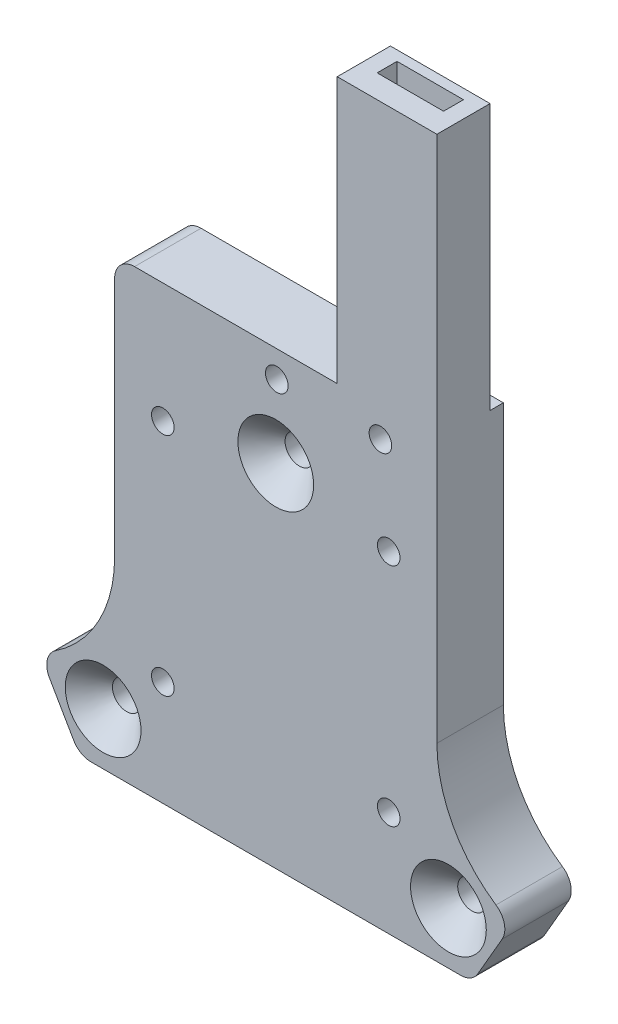
from build123d import *

# Parameters (mm, degrees)
SKETCH2_R                                       = 7.5
BOSS_EXTRUDE1_DEPTH                             = 10
CSK_FOR_M4_FLAT_HEAD_MACHINE_SCREW1_D           = 4.3
CSK_FOR_M4_FLAT_HEAD_MACHINE_SCREW1_CSINK_D     = 11.4
CSK_FOR_M4_FLAT_HEAD_MACHINE_SCREW1_CSINK_ANGLE = 90
FILLET1_R                                       = 20
CIRPATTERN2_COUNT                               = 3
FILLET2_R                                       = 3
SKETCH47_R                                      = 1.7
CUT_EXTRUDE1_DEPTH                              = 58.559983963
SKETCH49_W                                      = 15
SKETCH49_H                                      = 10
SKETCH49_W_2                                    = 10
SKETCH49_H_2                                    = 3
BOSS_EXTRUDE2_DEPTH                             = 40
CHAMFER1_SIZE                                   = 2
BOSS_EXTRUDE3_REACH                             = 78.74
SKETCH51_W                                      = 3
SKETCH51_H                                      = 10
BOSS_EXTRUDE4_DEPTH                             = 10
SKETCH48_R                                      = 1.7
CUT_EXTRUDE2_DEPTH                              = 93.266742447
CHAMFER4_SIZE                                   = 2
CHAMFER3_SIZE                                   = 2
SKETCH53_R                                      = 15.5
CUT_EXTRUDE3_DEPTH                              = 1.5
SKETCH54_R                                      = 7.5
BOSS_EXTRUDE5_DEPTH                             = 8.5
CUT_EXTRUDE4_DEPTH                              = 93.266742447


with BuildPart() as part:
    # Sketch2 → Boss-Extrude1 (new body)
    with BuildSketch(Plane.XY):
        Polygon((-24.25, 45), (24.25, 45), (24.25, -5.917840259), (35.54293994, -12.437822174), (29.54293994, -22.830127019), (-29.54293994, -22.830127019), (-35.54293994, -12.437822174), (-24.25, -5.917840259), align=None)
        Circle(SKETCH2_R, mode=Mode.SUBTRACT)
    extrude(amount=BOSS_EXTRUDE1_DEPTH)

    # CSK for M4 Flat Head Machine Screw1 (through all)
    with Locations(Plane.XY.offset(10)):
        with Locations((-25.980762114, -15), (0, 30), (25.980762114, -15)):
            CounterSinkHole(CSK_FOR_M4_FLAT_HEAD_MACHINE_SCREW1_D / 2, CSK_FOR_M4_FLAT_HEAD_MACHINE_SCREW1_CSINK_D / 2, counter_sink_angle=CSK_FOR_M4_FLAT_HEAD_MACHINE_SCREW1_CSINK_ANGLE)

    # Fillet1
    fillet1_edges = [part.edges().sort_by_distance(p)[0] for p in [
        (24.25, -5.917840259, 5),
        (-24.25, -5.917840259, 5),
    ]]
    fillet(fillet1_edges, radius=FILLET1_R)

    # Sketch46 → tool ball cutout (revolve, cut)
    with BuildSketch(Plane(origin=(0, 30, 0), x_dir=(1, 0, 0), z_dir=(0, 1, 0))):
        with BuildLine():
            Line((0, 5.3), (0, -4.7))
            ThreePointArc((0, -4.7), (-5, 0.3), (0, 5.3))
        make_face()
    tool_ball_cutout = revolve(axis=Axis((0, 30, 0), (0, 0, -1)), mode=Mode.SUBTRACT)

    # CirPattern2: tool ball cutout ×3 about axis
    cirpattern2_axis = Axis((0, 0, 0), (0, 0, 1))
    for i in range(1, CIRPATTERN2_COUNT):
        add(tool_ball_cutout.rotate(cirpattern2_axis, i * 360 / CIRPATTERN2_COUNT), mode=Mode.SUBTRACT)

    # Fillet2
    fillet2_edges = [part.edges().sort_by_distance(p)[0] for p in [
        (24.25, 45, 5),
        (-24.25, 45, 5),
        (-29.54293994, -22.830127019, 5),
        (-35.54293994, -12.437822174, 5),
        (29.54293994, -22.830127019, 5),
        (35.54293994, -12.437822174, 5),
    ]]
    fillet(fillet2_edges, radius=FILLET2_R)

    # Sketch47 → Cut-Extrude1 (cut, through all)
    with BuildSketch(Plane(origin=(0, 0, 0), x_dir=(-1, 0, 0), z_dir=(0, 0, -1))):
        with Locations((-17, 27)):
            Circle(SKETCH47_R)
        with Locations((17, 27)):
            Circle(SKETCH47_R)
        with Locations((17, -7)):
            Circle(SKETCH47_R)
        with Locations((-17, -7)):
            Circle(SKETCH47_R)
    extrude(amount=-CUT_EXTRUDE1_DEPTH, mode=Mode.SUBTRACT)

    # Sketch49 → Boss-Extrude2 (add)
    with BuildSketch(Plane(origin=(0, 45, 0), x_dir=(1, 0, 0), z_dir=(0, 1, 0))):
        with Locations((16.75, -5)):
            Rectangle(SKETCH49_W, SKETCH49_H)
        with Locations((16.75, -5)):
            Rectangle(SKETCH49_W_2, SKETCH49_H_2, mode=Mode.SUBTRACT)
    extrude(amount=BOSS_EXTRUDE2_DEPTH)

    # Chamfer1
    chamfer1_edges = [part.edges().sort_by_distance(p)[0] for p in [
        (18.7, -7, 0),
        (-15.3, -7, 0),
        (-15.3, 27, 0),
        (18.7, 27, 0),
    ]]
    chamfer(chamfer1_edges, length=CHAMFER1_SIZE)

    # Sketch51 → Boss-Extrude3 (add, up to next)
    with BuildSketch(Plane.XZ.offset(-45), mode=Mode.PRIVATE) as boss_extrude3_sk1:
        with Locations((22.75, 5)):
            Rectangle(SKETCH51_W, SKETCH51_H)
    boss_extrude3_tool1 = extrude(boss_extrude3_sk1.sketch, amount=BOSS_EXTRUDE3_REACH, mode=Mode.PRIVATE) - part.part
    add(boss_extrude3_tool1.solids().sort_by_distance((22.75, 45, 5))[0])

    # Sketch52 → Boss-Extrude4 (add)
    with BuildSketch(Plane.XY.offset(10)):
        with BuildLine():
            Line((24.25, 45), (31.75, 45))
            Line((31.75, 45), (31.75, -9.983329871))
            ThreePointArc((31.75, -9.983329871), (26.222243623, -3.031088913), (24.25, 5.629165125))
            Line((24.25, 5.629165125), (24.25, 45))
        make_face()
    extrude(amount=-BOSS_EXTRUDE4_DEPTH)

    # Sketch48 → Cut-Extrude2 (cut, through all)
    with BuildSketch(Plane.XY.offset(10)):
        with Locations((0.150338606, 41)):
            Circle(SKETCH48_R)
        with Locations((15.750338606, 41)):
            Circle(SKETCH48_R)
    extrude(amount=-CUT_EXTRUDE2_DEPTH, mode=Mode.SUBTRACT)

    # Chamfer4
    chamfer4_edges = [part.edges().sort_by_distance(p)[0] for p in [
        (-1.549661394, 41, 0),
        (14.050338606, 41, 0),
    ]]
    chamfer(chamfer4_edges, length=CHAMFER4_SIZE)

    # Chamfer3
    chamfer3_edges = [part.edges().sort_by_distance(p)[0] for p in [
        (16.75, 85, 0),
        (9.25, 65, 0),
        (24.25, 65, 0),
    ]]
    chamfer(chamfer3_edges, length=CHAMFER3_SIZE)

    # Sketch53 → Cut-Extrude3 (cut)
    with BuildSketch(Plane(origin=(0, 0, 0), x_dir=(-1, 0, 0), z_dir=(0, 0, -1))):
        Circle(SKETCH53_R)
    extrude(amount=-CUT_EXTRUDE3_DEPTH, mode=Mode.SUBTRACT)

    # Sketch54 → Boss-Extrude5 (add)
    with BuildSketch(Plane(origin=(0, 0, 1.5), x_dir=(-1, 0, 0), z_dir=(0, 0, -1))):
        Circle(SKETCH54_R)
    extrude(amount=-BOSS_EXTRUDE5_DEPTH)

    # Sketch55 → Cut-Extrude4 (cut, through all)
    with BuildSketch(Plane(origin=(0, 0, 0), x_dir=(-1, 0, 0), z_dir=(0, 0, -1))):
        with BuildLine():
            Line((-24.25, 45), (-24.25, 5.629165125))
            ThreePointArc((-24.25, 5.629165125), (-26.222243623, -3.031088913), (-31.75, -9.983329871))
            Line((-31.75, -9.983329871), (-31.75, 45))
            Line((-31.75, 45), (-24.25, 45))
        make_face()
    extrude(amount=-CUT_EXTRUDE4_DEPTH, mode=Mode.SUBTRACT)


solid = part.part
